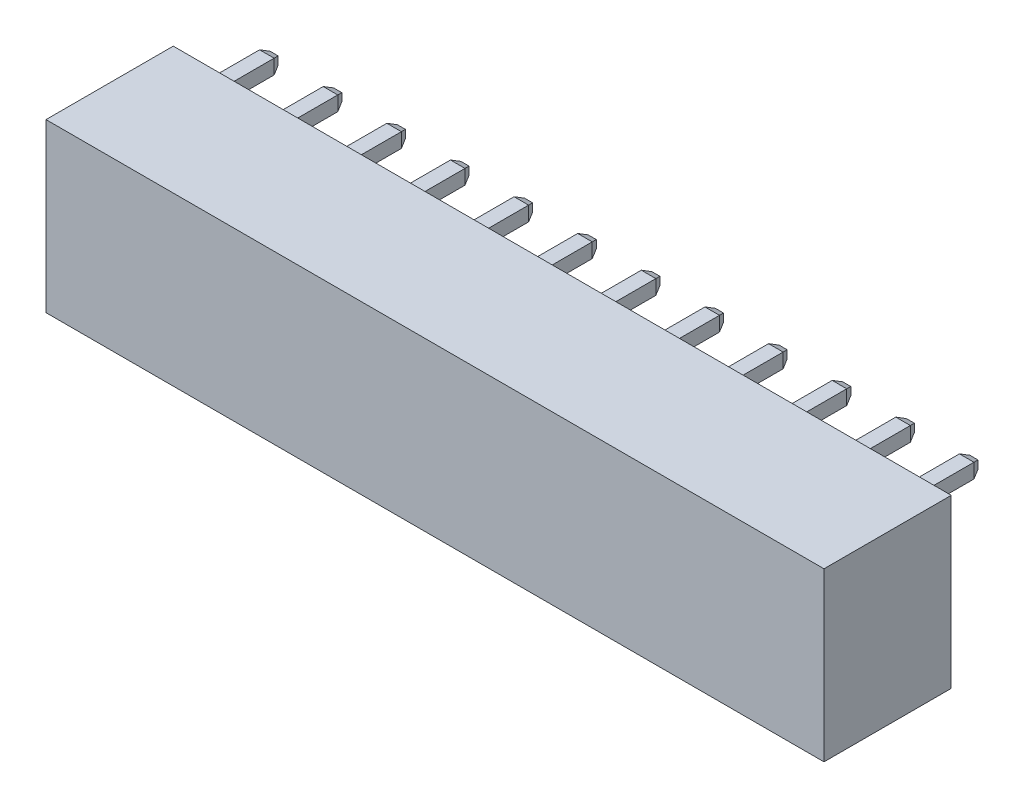
from build123d import *
from OCP.BRepFilletAPI import BRepFilletAPI_MakeChamfer

# Parameters (mm, degrees)
SKETCH_1_W                          = 42.8
SKETCH_1_H                          = 9.2
EXTRUDE_1_DEPTH                     = 7
SKETCH_2_W                          = 0.8
SKETCH_2_H                          = 0.8
EXTRUDE_2_DEPTH                     = 3.4
CHAMFER_1_SIZE                      = 0.4
CHAMFER_1_SIZE2                     = 0.178091474
CUT_EXTRUDE_1_DEPTH                 = 7
PATTERN_LINEAR_1_COUNT              = 12
PATTERN_LINEAR_1_PITCH              = 3.5
CHAMFER_1_OF_PATTERN_LINEAR_1_SIZE  = 0.4
CHAMFER_1_OF_PATTERN_LINEAR_1_SIZE2 = 0.178091474
PATTERN_LINEAR_2_COUNT              = 12
PATTERN_LINEAR_2_PITCH              = 3.5
SKETCH_4_W                          = 0.8
SKETCH_4_H                          = 0.8
EXTRUDE_3_DEPTH                     = 6
CHAMFER_2_SIZE                      = 0.4
CHAMFER_2_SIZE2                     = 0.178091474
PATTERN_LINEAR_3_COUNT              = 12
PATTERN_LINEAR_3_PITCH              = 3.5
CHAMFER_2_OF_PATTERN_LINEAR_3_SIZE  = 0.4
CHAMFER_2_OF_PATTERN_LINEAR_3_SIZE2 = 0.178091474


with BuildPart() as part:
    # Эскиз1 → Бобышка-Вытянуть1 (new body)
    with BuildSketch(Plane.XY):
        with Locations((0, 4.6)):
            Rectangle(SKETCH_1_W, SKETCH_1_H)
    extrude(amount=EXTRUDE_1_DEPTH)

    # Эскиз2 → Бобышка-Вытянуть2 (add)
    with BuildSketch(Plane(origin=(0, 0, 0), x_dir=(-1, 0, 0), z_dir=(0, 0, -1))):
        with Locations((-19.25, 8)):
            Rectangle(SKETCH_2_W, SKETCH_2_H)
    extrude_2 = extrude(amount=EXTRUDE_2_DEPTH)

    # Фаска1: one chamfer whose edges measure the first distance from different faces: ONE call of the kernel's chamfer builder (chamfer() names one face for all edges)
    chamfer_1_edges_1 = [part.edges().sort_by_distance(p)[0] for p in [
        (18.85, 8, -3.4),
    ]]
    chamfer_1_side_1 = [part.faces().sort_by_distance(p)[0] for p in [
        (18.85, 8, -1.7),
    ]]
    chamfer_1_edges_2 = [part.edges().sort_by_distance(p)[0] for p in [
        (19.25, 8.4, -3.4),
    ]]
    chamfer_1_side_2 = [part.faces().sort_by_distance(p)[0] for p in [
        (19.25, 8.4, -1.7),
    ]]
    chamfer_1_edges_3 = [part.edges().sort_by_distance(p)[0] for p in [
        (19.65, 8, -3.4),
    ]]
    chamfer_1_side_3 = [part.faces().sort_by_distance(p)[0] for p in [
        (19.65, 8, -1.7),
    ]]
    chamfer_1_edges_4 = [part.edges().sort_by_distance(p)[0] for p in [
        (19.25, 7.6, -3.4),
    ]]
    chamfer_1_side_4 = [part.faces().sort_by_distance(p)[0] for p in [
        (19.25, 7.6, -1.7),
    ]]
    chamfer_1 = BRepFilletAPI_MakeChamfer(part.part.solid().wrapped)
    for e in chamfer_1_edges_1:
        chamfer_1.Add(CHAMFER_1_SIZE, CHAMFER_1_SIZE2, e.wrapped, chamfer_1_side_1[0].wrapped)  # the first distance lies on this face
    for e in chamfer_1_edges_2:
        chamfer_1.Add(CHAMFER_1_SIZE, CHAMFER_1_SIZE2, e.wrapped, chamfer_1_side_2[0].wrapped)  # the first distance lies on this face
    for e in chamfer_1_edges_3:
        chamfer_1.Add(CHAMFER_1_SIZE, CHAMFER_1_SIZE2, e.wrapped, chamfer_1_side_3[0].wrapped)  # the first distance lies on this face
    for e in chamfer_1_edges_4:
        chamfer_1.Add(CHAMFER_1_SIZE, CHAMFER_1_SIZE2, e.wrapped, chamfer_1_side_4[0].wrapped)  # the first distance lies on this face
    add(Compound.cast(chamfer_1.Shape()), mode=Mode.REPLACE)

    # Эскиз3 → Вырез-Вытянуть1 (cut)
    with BuildSketch(Plane.XZ):
        Polygon((17.65, 0.8), (20.75, 0.8), (20.75, 5), (19.75, 5), (20.75, 6.5), (17.65, 6.5), (18.65, 5), (17.65, 5), align=None)
    cut_extrude_1 = extrude(amount=-CUT_EXTRUDE_1_DEPTH, mode=Mode.SUBTRACT)

    # Линейный массив1: Бобышка-Вытянуть2 ×12
    with Locations(*[(-i * PATTERN_LINEAR_1_PITCH, 0, 0) for i in range(1, PATTERN_LINEAR_1_COUNT)]):
        add(extrude_2)

    # Фаска1 of Линейный массив1: one chamfer whose edges measure the first distance from different faces: ONE call of the kernel's chamfer builder (chamfer() names one face for all edges)
    chamfer_1_of_pattern_linear_1_edges_1 = [part.edges().sort_by_distance(p)[0] for p in [
        (15.35, 8, -3.4),
    ]]
    chamfer_1_of_pattern_linear_1_side_1 = [part.faces().sort_by_distance(p)[0] for p in [
        (15.35, 8, -1.7),
    ]]
    chamfer_1_of_pattern_linear_1_edges_2 = [part.edges().sort_by_distance(p)[0] for p in [
        (15.75, 8.4, -3.4),
    ]]
    chamfer_1_of_pattern_linear_1_side_2 = [part.faces().sort_by_distance(p)[0] for p in [
        (15.75, 8.4, -1.7),
    ]]
    chamfer_1_of_pattern_linear_1_edges_3 = [part.edges().sort_by_distance(p)[0] for p in [
        (16.15, 8, -3.4),
    ]]
    chamfer_1_of_pattern_linear_1_side_3 = [part.faces().sort_by_distance(p)[0] for p in [
        (16.15, 8, -1.7),
    ]]
    chamfer_1_of_pattern_linear_1_edges_4 = [part.edges().sort_by_distance(p)[0] for p in [
        (15.75, 7.6, -3.4),
    ]]
    chamfer_1_of_pattern_linear_1_side_4 = [part.faces().sort_by_distance(p)[0] for p in [
        (15.75, 7.6, -1.7),
    ]]
    chamfer_1_of_pattern_linear_1_edges_5 = [part.edges().sort_by_distance(p)[0] for p in [
        (11.85, 8, -3.4),
    ]]
    chamfer_1_of_pattern_linear_1_side_5 = [part.faces().sort_by_distance(p)[0] for p in [
        (11.85, 8, -1.7),
    ]]
    chamfer_1_of_pattern_linear_1_edges_6 = [part.edges().sort_by_distance(p)[0] for p in [
        (12.25, 8.4, -3.4),
    ]]
    chamfer_1_of_pattern_linear_1_side_6 = [part.faces().sort_by_distance(p)[0] for p in [
        (12.25, 8.4, -1.7),
    ]]
    chamfer_1_of_pattern_linear_1_edges_7 = [part.edges().sort_by_distance(p)[0] for p in [
        (12.65, 8, -3.4),
    ]]
    chamfer_1_of_pattern_linear_1_side_7 = [part.faces().sort_by_distance(p)[0] for p in [
        (12.65, 8, -1.7),
    ]]
    chamfer_1_of_pattern_linear_1_edges_8 = [part.edges().sort_by_distance(p)[0] for p in [
        (12.25, 7.6, -3.4),
    ]]
    chamfer_1_of_pattern_linear_1_side_8 = [part.faces().sort_by_distance(p)[0] for p in [
        (12.25, 7.6, -1.7),
    ]]
    chamfer_1_of_pattern_linear_1_edges_9 = [part.edges().sort_by_distance(p)[0] for p in [
        (8.35, 8, -3.4),
    ]]
    chamfer_1_of_pattern_linear_1_side_9 = [part.faces().sort_by_distance(p)[0] for p in [
        (8.35, 8, -1.7),
    ]]
    chamfer_1_of_pattern_linear_1_edges_10 = [part.edges().sort_by_distance(p)[0] for p in [
        (8.75, 8.4, -3.4),
    ]]
    chamfer_1_of_pattern_linear_1_side_10 = [part.faces().sort_by_distance(p)[0] for p in [
        (8.75, 8.4, -1.7),
    ]]
    chamfer_1_of_pattern_linear_1_edges_11 = [part.edges().sort_by_distance(p)[0] for p in [
        (9.15, 8, -3.4),
    ]]
    chamfer_1_of_pattern_linear_1_side_11 = [part.faces().sort_by_distance(p)[0] for p in [
        (9.15, 8, -1.7),
    ]]
    chamfer_1_of_pattern_linear_1_edges_12 = [part.edges().sort_by_distance(p)[0] for p in [
        (8.75, 7.6, -3.4),
    ]]
    chamfer_1_of_pattern_linear_1_side_12 = [part.faces().sort_by_distance(p)[0] for p in [
        (8.75, 7.6, -1.7),
    ]]
    chamfer_1_of_pattern_linear_1_edges_13 = [part.edges().sort_by_distance(p)[0] for p in [
        (4.85, 8, -3.4),
    ]]
    chamfer_1_of_pattern_linear_1_side_13 = [part.faces().sort_by_distance(p)[0] for p in [
        (4.85, 8, -1.7),
    ]]
    chamfer_1_of_pattern_linear_1_edges_14 = [part.edges().sort_by_distance(p)[0] for p in [
        (5.25, 8.4, -3.4),
    ]]
    chamfer_1_of_pattern_linear_1_side_14 = [part.faces().sort_by_distance(p)[0] for p in [
        (5.25, 8.4, -1.7),
    ]]
    chamfer_1_of_pattern_linear_1_edges_15 = [part.edges().sort_by_distance(p)[0] for p in [
        (5.65, 8, -3.4),
    ]]
    chamfer_1_of_pattern_linear_1_side_15 = [part.faces().sort_by_distance(p)[0] for p in [
        (5.65, 8, -1.7),
    ]]
    chamfer_1_of_pattern_linear_1_edges_16 = [part.edges().sort_by_distance(p)[0] for p in [
        (5.25, 7.6, -3.4),
    ]]
    chamfer_1_of_pattern_linear_1_side_16 = [part.faces().sort_by_distance(p)[0] for p in [
        (5.25, 7.6, -1.7),
    ]]
    chamfer_1_of_pattern_linear_1_edges_17 = [part.edges().sort_by_distance(p)[0] for p in [
        (1.35, 8, -3.4),
    ]]
    chamfer_1_of_pattern_linear_1_side_17 = [part.faces().sort_by_distance(p)[0] for p in [
        (1.35, 8, -1.7),
    ]]
    chamfer_1_of_pattern_linear_1_edges_18 = [part.edges().sort_by_distance(p)[0] for p in [
        (1.75, 8.4, -3.4),
    ]]
    chamfer_1_of_pattern_linear_1_side_18 = [part.faces().sort_by_distance(p)[0] for p in [
        (1.75, 8.4, -1.7),
    ]]
    chamfer_1_of_pattern_linear_1_edges_19 = [part.edges().sort_by_distance(p)[0] for p in [
        (2.15, 8, -3.4),
    ]]
    chamfer_1_of_pattern_linear_1_side_19 = [part.faces().sort_by_distance(p)[0] for p in [
        (2.15, 8, -1.7),
    ]]
    chamfer_1_of_pattern_linear_1_edges_20 = [part.edges().sort_by_distance(p)[0] for p in [
        (1.75, 7.6, -3.4),
    ]]
    chamfer_1_of_pattern_linear_1_side_20 = [part.faces().sort_by_distance(p)[0] for p in [
        (1.75, 7.6, -1.7),
    ]]
    chamfer_1_of_pattern_linear_1_edges_21 = [part.edges().sort_by_distance(p)[0] for p in [
        (-2.15, 8, -3.4),
    ]]
    chamfer_1_of_pattern_linear_1_side_21 = [part.faces().sort_by_distance(p)[0] for p in [
        (-2.15, 8, -1.7),
    ]]
    chamfer_1_of_pattern_linear_1_edges_22 = [part.edges().sort_by_distance(p)[0] for p in [
        (-1.75, 8.4, -3.4),
    ]]
    chamfer_1_of_pattern_linear_1_side_22 = [part.faces().sort_by_distance(p)[0] for p in [
        (-1.75, 8.4, -1.7),
    ]]
    chamfer_1_of_pattern_linear_1_edges_23 = [part.edges().sort_by_distance(p)[0] for p in [
        (-1.35, 8, -3.4),
    ]]
    chamfer_1_of_pattern_linear_1_side_23 = [part.faces().sort_by_distance(p)[0] for p in [
        (-1.35, 8, -1.7),
    ]]
    chamfer_1_of_pattern_linear_1_edges_24 = [part.edges().sort_by_distance(p)[0] for p in [
        (-1.75, 7.6, -3.4),
    ]]
    chamfer_1_of_pattern_linear_1_side_24 = [part.faces().sort_by_distance(p)[0] for p in [
        (-1.75, 7.6, -1.7),
    ]]
    chamfer_1_of_pattern_linear_1_edges_25 = [part.edges().sort_by_distance(p)[0] for p in [
        (-5.65, 8, -3.4),
    ]]
    chamfer_1_of_pattern_linear_1_side_25 = [part.faces().sort_by_distance(p)[0] for p in [
        (-5.65, 8, -1.7),
    ]]
    chamfer_1_of_pattern_linear_1_edges_26 = [part.edges().sort_by_distance(p)[0] for p in [
        (-5.25, 8.4, -3.4),
    ]]
    chamfer_1_of_pattern_linear_1_side_26 = [part.faces().sort_by_distance(p)[0] for p in [
        (-5.25, 8.4, -1.7),
    ]]
    chamfer_1_of_pattern_linear_1_edges_27 = [part.edges().sort_by_distance(p)[0] for p in [
        (-4.85, 8, -3.4),
    ]]
    chamfer_1_of_pattern_linear_1_side_27 = [part.faces().sort_by_distance(p)[0] for p in [
        (-4.85, 8, -1.7),
    ]]
    chamfer_1_of_pattern_linear_1_edges_28 = [part.edges().sort_by_distance(p)[0] for p in [
        (-5.25, 7.6, -3.4),
    ]]
    chamfer_1_of_pattern_linear_1_side_28 = [part.faces().sort_by_distance(p)[0] for p in [
        (-5.25, 7.6, -1.7),
    ]]
    chamfer_1_of_pattern_linear_1_edges_29 = [part.edges().sort_by_distance(p)[0] for p in [
        (-9.15, 8, -3.4),
    ]]
    chamfer_1_of_pattern_linear_1_side_29 = [part.faces().sort_by_distance(p)[0] for p in [
        (-9.15, 8, -1.7),
    ]]
    chamfer_1_of_pattern_linear_1_edges_30 = [part.edges().sort_by_distance(p)[0] for p in [
        (-8.75, 8.4, -3.4),
    ]]
    chamfer_1_of_pattern_linear_1_side_30 = [part.faces().sort_by_distance(p)[0] for p in [
        (-8.75, 8.4, -1.7),
    ]]
    chamfer_1_of_pattern_linear_1_edges_31 = [part.edges().sort_by_distance(p)[0] for p in [
        (-8.35, 8, -3.4),
    ]]
    chamfer_1_of_pattern_linear_1_side_31 = [part.faces().sort_by_distance(p)[0] for p in [
        (-8.35, 8, -1.7),
    ]]
    chamfer_1_of_pattern_linear_1_edges_32 = [part.edges().sort_by_distance(p)[0] for p in [
        (-8.75, 7.6, -3.4),
    ]]
    chamfer_1_of_pattern_linear_1_side_32 = [part.faces().sort_by_distance(p)[0] for p in [
        (-8.75, 7.6, -1.7),
    ]]
    chamfer_1_of_pattern_linear_1_edges_33 = [part.edges().sort_by_distance(p)[0] for p in [
        (-12.65, 8, -3.4),
    ]]
    chamfer_1_of_pattern_linear_1_side_33 = [part.faces().sort_by_distance(p)[0] for p in [
        (-12.65, 8, -1.7),
    ]]
    chamfer_1_of_pattern_linear_1_edges_34 = [part.edges().sort_by_distance(p)[0] for p in [
        (-12.25, 8.4, -3.4),
    ]]
    chamfer_1_of_pattern_linear_1_side_34 = [part.faces().sort_by_distance(p)[0] for p in [
        (-12.25, 8.4, -1.7),
    ]]
    chamfer_1_of_pattern_linear_1_edges_35 = [part.edges().sort_by_distance(p)[0] for p in [
        (-11.85, 8, -3.4),
    ]]
    chamfer_1_of_pattern_linear_1_side_35 = [part.faces().sort_by_distance(p)[0] for p in [
        (-11.85, 8, -1.7),
    ]]
    chamfer_1_of_pattern_linear_1_edges_36 = [part.edges().sort_by_distance(p)[0] for p in [
        (-12.25, 7.6, -3.4),
    ]]
    chamfer_1_of_pattern_linear_1_side_36 = [part.faces().sort_by_distance(p)[0] for p in [
        (-12.25, 7.6, -1.7),
    ]]
    chamfer_1_of_pattern_linear_1_edges_37 = [part.edges().sort_by_distance(p)[0] for p in [
        (-16.15, 8, -3.4),
    ]]
    chamfer_1_of_pattern_linear_1_side_37 = [part.faces().sort_by_distance(p)[0] for p in [
        (-16.15, 8, -1.7),
    ]]
    chamfer_1_of_pattern_linear_1_edges_38 = [part.edges().sort_by_distance(p)[0] for p in [
        (-15.75, 8.4, -3.4),
    ]]
    chamfer_1_of_pattern_linear_1_side_38 = [part.faces().sort_by_distance(p)[0] for p in [
        (-15.75, 8.4, -1.7),
    ]]
    chamfer_1_of_pattern_linear_1_edges_39 = [part.edges().sort_by_distance(p)[0] for p in [
        (-15.35, 8, -3.4),
    ]]
    chamfer_1_of_pattern_linear_1_side_39 = [part.faces().sort_by_distance(p)[0] for p in [
        (-15.35, 8, -1.7),
    ]]
    chamfer_1_of_pattern_linear_1_edges_40 = [part.edges().sort_by_distance(p)[0] for p in [
        (-15.75, 7.6, -3.4),
    ]]
    chamfer_1_of_pattern_linear_1_side_40 = [part.faces().sort_by_distance(p)[0] for p in [
        (-15.75, 7.6, -1.7),
    ]]
    chamfer_1_of_pattern_linear_1_edges_41 = [part.edges().sort_by_distance(p)[0] for p in [
        (-19.65, 8, -3.4),
    ]]
    chamfer_1_of_pattern_linear_1_side_41 = [part.faces().sort_by_distance(p)[0] for p in [
        (-19.65, 8, -1.7),
    ]]
    chamfer_1_of_pattern_linear_1_edges_42 = [part.edges().sort_by_distance(p)[0] for p in [
        (-19.25, 8.4, -3.4),
    ]]
    chamfer_1_of_pattern_linear_1_side_42 = [part.faces().sort_by_distance(p)[0] for p in [
        (-19.25, 8.4, -1.7),
    ]]
    chamfer_1_of_pattern_linear_1_edges_43 = [part.edges().sort_by_distance(p)[0] for p in [
        (-18.85, 8, -3.4),
    ]]
    chamfer_1_of_pattern_linear_1_side_43 = [part.faces().sort_by_distance(p)[0] for p in [
        (-18.85, 8, -1.7),
    ]]
    chamfer_1_of_pattern_linear_1_edges_44 = [part.edges().sort_by_distance(p)[0] for p in [
        (-19.25, 7.6, -3.4),
    ]]
    chamfer_1_of_pattern_linear_1_side_44 = [part.faces().sort_by_distance(p)[0] for p in [
        (-19.25, 7.6, -1.7),
    ]]
    chamfer_1_of_pattern_linear_1 = BRepFilletAPI_MakeChamfer(part.part.solid().wrapped)
    for e in chamfer_1_of_pattern_linear_1_edges_1:
        chamfer_1_of_pattern_linear_1.Add(CHAMFER_1_OF_PATTERN_LINEAR_1_SIZE, CHAMFER_1_OF_PATTERN_LINEAR_1_SIZE2, e.wrapped, chamfer_1_of_pattern_linear_1_side_1[0].wrapped)  # the first distance lies on this face
    for e in chamfer_1_of_pattern_linear_1_edges_2:
        chamfer_1_of_pattern_linear_1.Add(CHAMFER_1_OF_PATTERN_LINEAR_1_SIZE, CHAMFER_1_OF_PATTERN_LINEAR_1_SIZE2, e.wrapped, chamfer_1_of_pattern_linear_1_side_2[0].wrapped)  # the first distance lies on this face
    for e in chamfer_1_of_pattern_linear_1_edges_3:
        chamfer_1_of_pattern_linear_1.Add(CHAMFER_1_OF_PATTERN_LINEAR_1_SIZE, CHAMFER_1_OF_PATTERN_LINEAR_1_SIZE2, e.wrapped, chamfer_1_of_pattern_linear_1_side_3[0].wrapped)  # the first distance lies on this face
    for e in chamfer_1_of_pattern_linear_1_edges_4:
        chamfer_1_of_pattern_linear_1.Add(CHAMFER_1_OF_PATTERN_LINEAR_1_SIZE, CHAMFER_1_OF_PATTERN_LINEAR_1_SIZE2, e.wrapped, chamfer_1_of_pattern_linear_1_side_4[0].wrapped)  # the first distance lies on this face
    for e in chamfer_1_of_pattern_linear_1_edges_5:
        chamfer_1_of_pattern_linear_1.Add(CHAMFER_1_OF_PATTERN_LINEAR_1_SIZE, CHAMFER_1_OF_PATTERN_LINEAR_1_SIZE2, e.wrapped, chamfer_1_of_pattern_linear_1_side_5[0].wrapped)  # the first distance lies on this face
    for e in chamfer_1_of_pattern_linear_1_edges_6:
        chamfer_1_of_pattern_linear_1.Add(CHAMFER_1_OF_PATTERN_LINEAR_1_SIZE, CHAMFER_1_OF_PATTERN_LINEAR_1_SIZE2, e.wrapped, chamfer_1_of_pattern_linear_1_side_6[0].wrapped)  # the first distance lies on this face
    for e in chamfer_1_of_pattern_linear_1_edges_7:
        chamfer_1_of_pattern_linear_1.Add(CHAMFER_1_OF_PATTERN_LINEAR_1_SIZE, CHAMFER_1_OF_PATTERN_LINEAR_1_SIZE2, e.wrapped, chamfer_1_of_pattern_linear_1_side_7[0].wrapped)  # the first distance lies on this face
    for e in chamfer_1_of_pattern_linear_1_edges_8:
        chamfer_1_of_pattern_linear_1.Add(CHAMFER_1_OF_PATTERN_LINEAR_1_SIZE, CHAMFER_1_OF_PATTERN_LINEAR_1_SIZE2, e.wrapped, chamfer_1_of_pattern_linear_1_side_8[0].wrapped)  # the first distance lies on this face
    for e in chamfer_1_of_pattern_linear_1_edges_9:
        chamfer_1_of_pattern_linear_1.Add(CHAMFER_1_OF_PATTERN_LINEAR_1_SIZE, CHAMFER_1_OF_PATTERN_LINEAR_1_SIZE2, e.wrapped, chamfer_1_of_pattern_linear_1_side_9[0].wrapped)  # the first distance lies on this face
    for e in chamfer_1_of_pattern_linear_1_edges_10:
        chamfer_1_of_pattern_linear_1.Add(CHAMFER_1_OF_PATTERN_LINEAR_1_SIZE, CHAMFER_1_OF_PATTERN_LINEAR_1_SIZE2, e.wrapped, chamfer_1_of_pattern_linear_1_side_10[0].wrapped)  # the first distance lies on this face
    for e in chamfer_1_of_pattern_linear_1_edges_11:
        chamfer_1_of_pattern_linear_1.Add(CHAMFER_1_OF_PATTERN_LINEAR_1_SIZE, CHAMFER_1_OF_PATTERN_LINEAR_1_SIZE2, e.wrapped, chamfer_1_of_pattern_linear_1_side_11[0].wrapped)  # the first distance lies on this face
    for e in chamfer_1_of_pattern_linear_1_edges_12:
        chamfer_1_of_pattern_linear_1.Add(CHAMFER_1_OF_PATTERN_LINEAR_1_SIZE, CHAMFER_1_OF_PATTERN_LINEAR_1_SIZE2, e.wrapped, chamfer_1_of_pattern_linear_1_side_12[0].wrapped)  # the first distance lies on this face
    for e in chamfer_1_of_pattern_linear_1_edges_13:
        chamfer_1_of_pattern_linear_1.Add(CHAMFER_1_OF_PATTERN_LINEAR_1_SIZE, CHAMFER_1_OF_PATTERN_LINEAR_1_SIZE2, e.wrapped, chamfer_1_of_pattern_linear_1_side_13[0].wrapped)  # the first distance lies on this face
    for e in chamfer_1_of_pattern_linear_1_edges_14:
        chamfer_1_of_pattern_linear_1.Add(CHAMFER_1_OF_PATTERN_LINEAR_1_SIZE, CHAMFER_1_OF_PATTERN_LINEAR_1_SIZE2, e.wrapped, chamfer_1_of_pattern_linear_1_side_14[0].wrapped)  # the first distance lies on this face
    for e in chamfer_1_of_pattern_linear_1_edges_15:
        chamfer_1_of_pattern_linear_1.Add(CHAMFER_1_OF_PATTERN_LINEAR_1_SIZE, CHAMFER_1_OF_PATTERN_LINEAR_1_SIZE2, e.wrapped, chamfer_1_of_pattern_linear_1_side_15[0].wrapped)  # the first distance lies on this face
    for e in chamfer_1_of_pattern_linear_1_edges_16:
        chamfer_1_of_pattern_linear_1.Add(CHAMFER_1_OF_PATTERN_LINEAR_1_SIZE, CHAMFER_1_OF_PATTERN_LINEAR_1_SIZE2, e.wrapped, chamfer_1_of_pattern_linear_1_side_16[0].wrapped)  # the first distance lies on this face
    for e in chamfer_1_of_pattern_linear_1_edges_17:
        chamfer_1_of_pattern_linear_1.Add(CHAMFER_1_OF_PATTERN_LINEAR_1_SIZE, CHAMFER_1_OF_PATTERN_LINEAR_1_SIZE2, e.wrapped, chamfer_1_of_pattern_linear_1_side_17[0].wrapped)  # the first distance lies on this face
    for e in chamfer_1_of_pattern_linear_1_edges_18:
        chamfer_1_of_pattern_linear_1.Add(CHAMFER_1_OF_PATTERN_LINEAR_1_SIZE, CHAMFER_1_OF_PATTERN_LINEAR_1_SIZE2, e.wrapped, chamfer_1_of_pattern_linear_1_side_18[0].wrapped)  # the first distance lies on this face
    for e in chamfer_1_of_pattern_linear_1_edges_19:
        chamfer_1_of_pattern_linear_1.Add(CHAMFER_1_OF_PATTERN_LINEAR_1_SIZE, CHAMFER_1_OF_PATTERN_LINEAR_1_SIZE2, e.wrapped, chamfer_1_of_pattern_linear_1_side_19[0].wrapped)  # the first distance lies on this face
    for e in chamfer_1_of_pattern_linear_1_edges_20:
        chamfer_1_of_pattern_linear_1.Add(CHAMFER_1_OF_PATTERN_LINEAR_1_SIZE, CHAMFER_1_OF_PATTERN_LINEAR_1_SIZE2, e.wrapped, chamfer_1_of_pattern_linear_1_side_20[0].wrapped)  # the first distance lies on this face
    for e in chamfer_1_of_pattern_linear_1_edges_21:
        chamfer_1_of_pattern_linear_1.Add(CHAMFER_1_OF_PATTERN_LINEAR_1_SIZE, CHAMFER_1_OF_PATTERN_LINEAR_1_SIZE2, e.wrapped, chamfer_1_of_pattern_linear_1_side_21[0].wrapped)  # the first distance lies on this face
    for e in chamfer_1_of_pattern_linear_1_edges_22:
        chamfer_1_of_pattern_linear_1.Add(CHAMFER_1_OF_PATTERN_LINEAR_1_SIZE, CHAMFER_1_OF_PATTERN_LINEAR_1_SIZE2, e.wrapped, chamfer_1_of_pattern_linear_1_side_22[0].wrapped)  # the first distance lies on this face
    for e in chamfer_1_of_pattern_linear_1_edges_23:
        chamfer_1_of_pattern_linear_1.Add(CHAMFER_1_OF_PATTERN_LINEAR_1_SIZE, CHAMFER_1_OF_PATTERN_LINEAR_1_SIZE2, e.wrapped, chamfer_1_of_pattern_linear_1_side_23[0].wrapped)  # the first distance lies on this face
    for e in chamfer_1_of_pattern_linear_1_edges_24:
        chamfer_1_of_pattern_linear_1.Add(CHAMFER_1_OF_PATTERN_LINEAR_1_SIZE, CHAMFER_1_OF_PATTERN_LINEAR_1_SIZE2, e.wrapped, chamfer_1_of_pattern_linear_1_side_24[0].wrapped)  # the first distance lies on this face
    for e in chamfer_1_of_pattern_linear_1_edges_25:
        chamfer_1_of_pattern_linear_1.Add(CHAMFER_1_OF_PATTERN_LINEAR_1_SIZE, CHAMFER_1_OF_PATTERN_LINEAR_1_SIZE2, e.wrapped, chamfer_1_of_pattern_linear_1_side_25[0].wrapped)  # the first distance lies on this face
    for e in chamfer_1_of_pattern_linear_1_edges_26:
        chamfer_1_of_pattern_linear_1.Add(CHAMFER_1_OF_PATTERN_LINEAR_1_SIZE, CHAMFER_1_OF_PATTERN_LINEAR_1_SIZE2, e.wrapped, chamfer_1_of_pattern_linear_1_side_26[0].wrapped)  # the first distance lies on this face
    for e in chamfer_1_of_pattern_linear_1_edges_27:
        chamfer_1_of_pattern_linear_1.Add(CHAMFER_1_OF_PATTERN_LINEAR_1_SIZE, CHAMFER_1_OF_PATTERN_LINEAR_1_SIZE2, e.wrapped, chamfer_1_of_pattern_linear_1_side_27[0].wrapped)  # the first distance lies on this face
    for e in chamfer_1_of_pattern_linear_1_edges_28:
        chamfer_1_of_pattern_linear_1.Add(CHAMFER_1_OF_PATTERN_LINEAR_1_SIZE, CHAMFER_1_OF_PATTERN_LINEAR_1_SIZE2, e.wrapped, chamfer_1_of_pattern_linear_1_side_28[0].wrapped)  # the first distance lies on this face
    for e in chamfer_1_of_pattern_linear_1_edges_29:
        chamfer_1_of_pattern_linear_1.Add(CHAMFER_1_OF_PATTERN_LINEAR_1_SIZE, CHAMFER_1_OF_PATTERN_LINEAR_1_SIZE2, e.wrapped, chamfer_1_of_pattern_linear_1_side_29[0].wrapped)  # the first distance lies on this face
    for e in chamfer_1_of_pattern_linear_1_edges_30:
        chamfer_1_of_pattern_linear_1.Add(CHAMFER_1_OF_PATTERN_LINEAR_1_SIZE, CHAMFER_1_OF_PATTERN_LINEAR_1_SIZE2, e.wrapped, chamfer_1_of_pattern_linear_1_side_30[0].wrapped)  # the first distance lies on this face
    for e in chamfer_1_of_pattern_linear_1_edges_31:
        chamfer_1_of_pattern_linear_1.Add(CHAMFER_1_OF_PATTERN_LINEAR_1_SIZE, CHAMFER_1_OF_PATTERN_LINEAR_1_SIZE2, e.wrapped, chamfer_1_of_pattern_linear_1_side_31[0].wrapped)  # the first distance lies on this face
    for e in chamfer_1_of_pattern_linear_1_edges_32:
        chamfer_1_of_pattern_linear_1.Add(CHAMFER_1_OF_PATTERN_LINEAR_1_SIZE, CHAMFER_1_OF_PATTERN_LINEAR_1_SIZE2, e.wrapped, chamfer_1_of_pattern_linear_1_side_32[0].wrapped)  # the first distance lies on this face
    for e in chamfer_1_of_pattern_linear_1_edges_33:
        chamfer_1_of_pattern_linear_1.Add(CHAMFER_1_OF_PATTERN_LINEAR_1_SIZE, CHAMFER_1_OF_PATTERN_LINEAR_1_SIZE2, e.wrapped, chamfer_1_of_pattern_linear_1_side_33[0].wrapped)  # the first distance lies on this face
    for e in chamfer_1_of_pattern_linear_1_edges_34:
        chamfer_1_of_pattern_linear_1.Add(CHAMFER_1_OF_PATTERN_LINEAR_1_SIZE, CHAMFER_1_OF_PATTERN_LINEAR_1_SIZE2, e.wrapped, chamfer_1_of_pattern_linear_1_side_34[0].wrapped)  # the first distance lies on this face
    for e in chamfer_1_of_pattern_linear_1_edges_35:
        chamfer_1_of_pattern_linear_1.Add(CHAMFER_1_OF_PATTERN_LINEAR_1_SIZE, CHAMFER_1_OF_PATTERN_LINEAR_1_SIZE2, e.wrapped, chamfer_1_of_pattern_linear_1_side_35[0].wrapped)  # the first distance lies on this face
    for e in chamfer_1_of_pattern_linear_1_edges_36:
        chamfer_1_of_pattern_linear_1.Add(CHAMFER_1_OF_PATTERN_LINEAR_1_SIZE, CHAMFER_1_OF_PATTERN_LINEAR_1_SIZE2, e.wrapped, chamfer_1_of_pattern_linear_1_side_36[0].wrapped)  # the first distance lies on this face
    for e in chamfer_1_of_pattern_linear_1_edges_37:
        chamfer_1_of_pattern_linear_1.Add(CHAMFER_1_OF_PATTERN_LINEAR_1_SIZE, CHAMFER_1_OF_PATTERN_LINEAR_1_SIZE2, e.wrapped, chamfer_1_of_pattern_linear_1_side_37[0].wrapped)  # the first distance lies on this face
    for e in chamfer_1_of_pattern_linear_1_edges_38:
        chamfer_1_of_pattern_linear_1.Add(CHAMFER_1_OF_PATTERN_LINEAR_1_SIZE, CHAMFER_1_OF_PATTERN_LINEAR_1_SIZE2, e.wrapped, chamfer_1_of_pattern_linear_1_side_38[0].wrapped)  # the first distance lies on this face
    for e in chamfer_1_of_pattern_linear_1_edges_39:
        chamfer_1_of_pattern_linear_1.Add(CHAMFER_1_OF_PATTERN_LINEAR_1_SIZE, CHAMFER_1_OF_PATTERN_LINEAR_1_SIZE2, e.wrapped, chamfer_1_of_pattern_linear_1_side_39[0].wrapped)  # the first distance lies on this face
    for e in chamfer_1_of_pattern_linear_1_edges_40:
        chamfer_1_of_pattern_linear_1.Add(CHAMFER_1_OF_PATTERN_LINEAR_1_SIZE, CHAMFER_1_OF_PATTERN_LINEAR_1_SIZE2, e.wrapped, chamfer_1_of_pattern_linear_1_side_40[0].wrapped)  # the first distance lies on this face
    for e in chamfer_1_of_pattern_linear_1_edges_41:
        chamfer_1_of_pattern_linear_1.Add(CHAMFER_1_OF_PATTERN_LINEAR_1_SIZE, CHAMFER_1_OF_PATTERN_LINEAR_1_SIZE2, e.wrapped, chamfer_1_of_pattern_linear_1_side_41[0].wrapped)  # the first distance lies on this face
    for e in chamfer_1_of_pattern_linear_1_edges_42:
        chamfer_1_of_pattern_linear_1.Add(CHAMFER_1_OF_PATTERN_LINEAR_1_SIZE, CHAMFER_1_OF_PATTERN_LINEAR_1_SIZE2, e.wrapped, chamfer_1_of_pattern_linear_1_side_42[0].wrapped)  # the first distance lies on this face
    for e in chamfer_1_of_pattern_linear_1_edges_43:
        chamfer_1_of_pattern_linear_1.Add(CHAMFER_1_OF_PATTERN_LINEAR_1_SIZE, CHAMFER_1_OF_PATTERN_LINEAR_1_SIZE2, e.wrapped, chamfer_1_of_pattern_linear_1_side_43[0].wrapped)  # the first distance lies on this face
    for e in chamfer_1_of_pattern_linear_1_edges_44:
        chamfer_1_of_pattern_linear_1.Add(CHAMFER_1_OF_PATTERN_LINEAR_1_SIZE, CHAMFER_1_OF_PATTERN_LINEAR_1_SIZE2, e.wrapped, chamfer_1_of_pattern_linear_1_side_44[0].wrapped)  # the first distance lies on this face
    add(Compound.cast(chamfer_1_of_pattern_linear_1.Shape()), mode=Mode.REPLACE)

    # Линейный массив2: Вырез-Вытянуть1 ×12
    with Locations(*[(-i * PATTERN_LINEAR_2_PITCH, 0, 0) for i in range(1, PATTERN_LINEAR_2_COUNT)]):
        add(cut_extrude_1, mode=Mode.SUBTRACT)

    # Эскиз4 → Бобышка-Вытянуть3 (add)
    with BuildSketch(Plane.XZ.offset(-7)):
        with Locations((19.25, 3)):
            Rectangle(SKETCH_4_W, SKETCH_4_H)
    extrude_3 = extrude(amount=EXTRUDE_3_DEPTH)

    # Фаска2: one chamfer whose edges measure the first distance from different faces: ONE call of the kernel's chamfer builder (chamfer() names one face for all edges)
    chamfer_2_edges_1 = [part.edges().sort_by_distance(p)[0] for p in [
        (19.65, 1, 3),
    ]]
    chamfer_2_side_1 = [part.faces().sort_by_distance(p)[0] for p in [
        (19.65, 4, 3),
    ]]
    chamfer_2_edges_2 = [part.edges().sort_by_distance(p)[0] for p in [
        (19.25, 1, 3.4),
    ]]
    chamfer_2_side_2 = [part.faces().sort_by_distance(p)[0] for p in [
        (19.25, 4, 3.4),
    ]]
    chamfer_2_edges_3 = [part.edges().sort_by_distance(p)[0] for p in [
        (18.85, 1, 3),
    ]]
    chamfer_2_side_3 = [part.faces().sort_by_distance(p)[0] for p in [
        (18.85, 4, 3),
    ]]
    chamfer_2_edges_4 = [part.edges().sort_by_distance(p)[0] for p in [
        (19.25, 1, 2.6),
    ]]
    chamfer_2_side_4 = [part.faces().sort_by_distance(p)[0] for p in [
        (19.25, 4, 2.6),
    ]]
    chamfer_2 = BRepFilletAPI_MakeChamfer(part.part.solid().wrapped)
    for e in chamfer_2_edges_1:
        chamfer_2.Add(CHAMFER_2_SIZE, CHAMFER_2_SIZE2, e.wrapped, chamfer_2_side_1[0].wrapped)  # the first distance lies on this face
    for e in chamfer_2_edges_2:
        chamfer_2.Add(CHAMFER_2_SIZE, CHAMFER_2_SIZE2, e.wrapped, chamfer_2_side_2[0].wrapped)  # the first distance lies on this face
    for e in chamfer_2_edges_3:
        chamfer_2.Add(CHAMFER_2_SIZE, CHAMFER_2_SIZE2, e.wrapped, chamfer_2_side_3[0].wrapped)  # the first distance lies on this face
    for e in chamfer_2_edges_4:
        chamfer_2.Add(CHAMFER_2_SIZE, CHAMFER_2_SIZE2, e.wrapped, chamfer_2_side_4[0].wrapped)  # the first distance lies on this face
    add(Compound.cast(chamfer_2.Shape()), mode=Mode.REPLACE)

    # Линейный массив3: Бобышка-Вытянуть3 ×12
    with Locations(*[(-i * PATTERN_LINEAR_3_PITCH, 0, 0) for i in range(1, PATTERN_LINEAR_3_COUNT)]):
        add(extrude_3)

    # Фаска2 of Линейный массив3: one chamfer whose edges measure the first distance from different faces: ONE call of the kernel's chamfer builder (chamfer() names one face for all edges)
    chamfer_2_of_pattern_linear_3_edges_1 = [part.edges().sort_by_distance(p)[0] for p in [
        (16.15, 1, 3),
    ]]
    chamfer_2_of_pattern_linear_3_side_1 = [part.faces().sort_by_distance(p)[0] for p in [
        (16.15, 4, 3),
    ]]
    chamfer_2_of_pattern_linear_3_edges_2 = [part.edges().sort_by_distance(p)[0] for p in [
        (15.75, 1, 3.4),
    ]]
    chamfer_2_of_pattern_linear_3_side_2 = [part.faces().sort_by_distance(p)[0] for p in [
        (15.75, 4, 3.4),
    ]]
    chamfer_2_of_pattern_linear_3_edges_3 = [part.edges().sort_by_distance(p)[0] for p in [
        (15.35, 1, 3),
    ]]
    chamfer_2_of_pattern_linear_3_side_3 = [part.faces().sort_by_distance(p)[0] for p in [
        (15.35, 4, 3),
    ]]
    chamfer_2_of_pattern_linear_3_edges_4 = [part.edges().sort_by_distance(p)[0] for p in [
        (15.75, 1, 2.6),
    ]]
    chamfer_2_of_pattern_linear_3_side_4 = [part.faces().sort_by_distance(p)[0] for p in [
        (15.75, 4, 2.6),
    ]]
    chamfer_2_of_pattern_linear_3_edges_5 = [part.edges().sort_by_distance(p)[0] for p in [
        (12.65, 1, 3),
    ]]
    chamfer_2_of_pattern_linear_3_side_5 = [part.faces().sort_by_distance(p)[0] for p in [
        (12.65, 4, 3),
    ]]
    chamfer_2_of_pattern_linear_3_edges_6 = [part.edges().sort_by_distance(p)[0] for p in [
        (12.25, 1, 3.4),
    ]]
    chamfer_2_of_pattern_linear_3_side_6 = [part.faces().sort_by_distance(p)[0] for p in [
        (12.25, 4, 3.4),
    ]]
    chamfer_2_of_pattern_linear_3_edges_7 = [part.edges().sort_by_distance(p)[0] for p in [
        (11.85, 1, 3),
    ]]
    chamfer_2_of_pattern_linear_3_side_7 = [part.faces().sort_by_distance(p)[0] for p in [
        (11.85, 4, 3),
    ]]
    chamfer_2_of_pattern_linear_3_edges_8 = [part.edges().sort_by_distance(p)[0] for p in [
        (12.25, 1, 2.6),
    ]]
    chamfer_2_of_pattern_linear_3_side_8 = [part.faces().sort_by_distance(p)[0] for p in [
        (12.25, 4, 2.6),
    ]]
    chamfer_2_of_pattern_linear_3_edges_9 = [part.edges().sort_by_distance(p)[0] for p in [
        (9.15, 1, 3),
    ]]
    chamfer_2_of_pattern_linear_3_side_9 = [part.faces().sort_by_distance(p)[0] for p in [
        (9.15, 4, 3),
    ]]
    chamfer_2_of_pattern_linear_3_edges_10 = [part.edges().sort_by_distance(p)[0] for p in [
        (8.75, 1, 3.4),
    ]]
    chamfer_2_of_pattern_linear_3_side_10 = [part.faces().sort_by_distance(p)[0] for p in [
        (8.75, 4, 3.4),
    ]]
    chamfer_2_of_pattern_linear_3_edges_11 = [part.edges().sort_by_distance(p)[0] for p in [
        (8.35, 1, 3),
    ]]
    chamfer_2_of_pattern_linear_3_side_11 = [part.faces().sort_by_distance(p)[0] for p in [
        (8.35, 4, 3),
    ]]
    chamfer_2_of_pattern_linear_3_edges_12 = [part.edges().sort_by_distance(p)[0] for p in [
        (8.75, 1, 2.6),
    ]]
    chamfer_2_of_pattern_linear_3_side_12 = [part.faces().sort_by_distance(p)[0] for p in [
        (8.75, 4, 2.6),
    ]]
    chamfer_2_of_pattern_linear_3_edges_13 = [part.edges().sort_by_distance(p)[0] for p in [
        (5.65, 1, 3),
    ]]
    chamfer_2_of_pattern_linear_3_side_13 = [part.faces().sort_by_distance(p)[0] for p in [
        (5.65, 4, 3),
    ]]
    chamfer_2_of_pattern_linear_3_edges_14 = [part.edges().sort_by_distance(p)[0] for p in [
        (5.25, 1, 3.4),
    ]]
    chamfer_2_of_pattern_linear_3_side_14 = [part.faces().sort_by_distance(p)[0] for p in [
        (5.25, 4, 3.4),
    ]]
    chamfer_2_of_pattern_linear_3_edges_15 = [part.edges().sort_by_distance(p)[0] for p in [
        (4.85, 1, 3),
    ]]
    chamfer_2_of_pattern_linear_3_side_15 = [part.faces().sort_by_distance(p)[0] for p in [
        (4.85, 4, 3),
    ]]
    chamfer_2_of_pattern_linear_3_edges_16 = [part.edges().sort_by_distance(p)[0] for p in [
        (5.25, 1, 2.6),
    ]]
    chamfer_2_of_pattern_linear_3_side_16 = [part.faces().sort_by_distance(p)[0] for p in [
        (5.25, 4, 2.6),
    ]]
    chamfer_2_of_pattern_linear_3_edges_17 = [part.edges().sort_by_distance(p)[0] for p in [
        (2.15, 1, 3),
    ]]
    chamfer_2_of_pattern_linear_3_side_17 = [part.faces().sort_by_distance(p)[0] for p in [
        (2.15, 4, 3),
    ]]
    chamfer_2_of_pattern_linear_3_edges_18 = [part.edges().sort_by_distance(p)[0] for p in [
        (1.75, 1, 3.4),
    ]]
    chamfer_2_of_pattern_linear_3_side_18 = [part.faces().sort_by_distance(p)[0] for p in [
        (1.75, 4, 3.4),
    ]]
    chamfer_2_of_pattern_linear_3_edges_19 = [part.edges().sort_by_distance(p)[0] for p in [
        (1.35, 1, 3),
    ]]
    chamfer_2_of_pattern_linear_3_side_19 = [part.faces().sort_by_distance(p)[0] for p in [
        (1.35, 4, 3),
    ]]
    chamfer_2_of_pattern_linear_3_edges_20 = [part.edges().sort_by_distance(p)[0] for p in [
        (1.75, 1, 2.6),
    ]]
    chamfer_2_of_pattern_linear_3_side_20 = [part.faces().sort_by_distance(p)[0] for p in [
        (1.75, 4, 2.6),
    ]]
    chamfer_2_of_pattern_linear_3_edges_21 = [part.edges().sort_by_distance(p)[0] for p in [
        (-1.35, 1, 3),
    ]]
    chamfer_2_of_pattern_linear_3_side_21 = [part.faces().sort_by_distance(p)[0] for p in [
        (-1.35, 4, 3),
    ]]
    chamfer_2_of_pattern_linear_3_edges_22 = [part.edges().sort_by_distance(p)[0] for p in [
        (-1.75, 1, 3.4),
    ]]
    chamfer_2_of_pattern_linear_3_side_22 = [part.faces().sort_by_distance(p)[0] for p in [
        (-1.75, 4, 3.4),
    ]]
    chamfer_2_of_pattern_linear_3_edges_23 = [part.edges().sort_by_distance(p)[0] for p in [
        (-2.15, 1, 3),
    ]]
    chamfer_2_of_pattern_linear_3_side_23 = [part.faces().sort_by_distance(p)[0] for p in [
        (-2.15, 4, 3),
    ]]
    chamfer_2_of_pattern_linear_3_edges_24 = [part.edges().sort_by_distance(p)[0] for p in [
        (-1.75, 1, 2.6),
    ]]
    chamfer_2_of_pattern_linear_3_side_24 = [part.faces().sort_by_distance(p)[0] for p in [
        (-1.75, 4, 2.6),
    ]]
    chamfer_2_of_pattern_linear_3_edges_25 = [part.edges().sort_by_distance(p)[0] for p in [
        (-4.85, 1, 3),
    ]]
    chamfer_2_of_pattern_linear_3_side_25 = [part.faces().sort_by_distance(p)[0] for p in [
        (-4.85, 4, 3),
    ]]
    chamfer_2_of_pattern_linear_3_edges_26 = [part.edges().sort_by_distance(p)[0] for p in [
        (-5.25, 1, 3.4),
    ]]
    chamfer_2_of_pattern_linear_3_side_26 = [part.faces().sort_by_distance(p)[0] for p in [
        (-5.25, 4, 3.4),
    ]]
    chamfer_2_of_pattern_linear_3_edges_27 = [part.edges().sort_by_distance(p)[0] for p in [
        (-5.65, 1, 3),
    ]]
    chamfer_2_of_pattern_linear_3_side_27 = [part.faces().sort_by_distance(p)[0] for p in [
        (-5.65, 4, 3),
    ]]
    chamfer_2_of_pattern_linear_3_edges_28 = [part.edges().sort_by_distance(p)[0] for p in [
        (-5.25, 1, 2.6),
    ]]
    chamfer_2_of_pattern_linear_3_side_28 = [part.faces().sort_by_distance(p)[0] for p in [
        (-5.25, 4, 2.6),
    ]]
    chamfer_2_of_pattern_linear_3_edges_29 = [part.edges().sort_by_distance(p)[0] for p in [
        (-8.35, 1, 3),
    ]]
    chamfer_2_of_pattern_linear_3_side_29 = [part.faces().sort_by_distance(p)[0] for p in [
        (-8.35, 4, 3),
    ]]
    chamfer_2_of_pattern_linear_3_edges_30 = [part.edges().sort_by_distance(p)[0] for p in [
        (-8.75, 1, 3.4),
    ]]
    chamfer_2_of_pattern_linear_3_side_30 = [part.faces().sort_by_distance(p)[0] for p in [
        (-8.75, 4, 3.4),
    ]]
    chamfer_2_of_pattern_linear_3_edges_31 = [part.edges().sort_by_distance(p)[0] for p in [
        (-9.15, 1, 3),
    ]]
    chamfer_2_of_pattern_linear_3_side_31 = [part.faces().sort_by_distance(p)[0] for p in [
        (-9.15, 4, 3),
    ]]
    chamfer_2_of_pattern_linear_3_edges_32 = [part.edges().sort_by_distance(p)[0] for p in [
        (-8.75, 1, 2.6),
    ]]
    chamfer_2_of_pattern_linear_3_side_32 = [part.faces().sort_by_distance(p)[0] for p in [
        (-8.75, 4, 2.6),
    ]]
    chamfer_2_of_pattern_linear_3_edges_33 = [part.edges().sort_by_distance(p)[0] for p in [
        (-11.85, 1, 3),
    ]]
    chamfer_2_of_pattern_linear_3_side_33 = [part.faces().sort_by_distance(p)[0] for p in [
        (-11.85, 4, 3),
    ]]
    chamfer_2_of_pattern_linear_3_edges_34 = [part.edges().sort_by_distance(p)[0] for p in [
        (-12.25, 1, 3.4),
    ]]
    chamfer_2_of_pattern_linear_3_side_34 = [part.faces().sort_by_distance(p)[0] for p in [
        (-12.25, 4, 3.4),
    ]]
    chamfer_2_of_pattern_linear_3_edges_35 = [part.edges().sort_by_distance(p)[0] for p in [
        (-12.65, 1, 3),
    ]]
    chamfer_2_of_pattern_linear_3_side_35 = [part.faces().sort_by_distance(p)[0] for p in [
        (-12.65, 4, 3),
    ]]
    chamfer_2_of_pattern_linear_3_edges_36 = [part.edges().sort_by_distance(p)[0] for p in [
        (-12.25, 1, 2.6),
    ]]
    chamfer_2_of_pattern_linear_3_side_36 = [part.faces().sort_by_distance(p)[0] for p in [
        (-12.25, 4, 2.6),
    ]]
    chamfer_2_of_pattern_linear_3_edges_37 = [part.edges().sort_by_distance(p)[0] for p in [
        (-15.35, 1, 3),
    ]]
    chamfer_2_of_pattern_linear_3_side_37 = [part.faces().sort_by_distance(p)[0] for p in [
        (-15.35, 4, 3),
    ]]
    chamfer_2_of_pattern_linear_3_edges_38 = [part.edges().sort_by_distance(p)[0] for p in [
        (-15.75, 1, 3.4),
    ]]
    chamfer_2_of_pattern_linear_3_side_38 = [part.faces().sort_by_distance(p)[0] for p in [
        (-15.75, 4, 3.4),
    ]]
    chamfer_2_of_pattern_linear_3_edges_39 = [part.edges().sort_by_distance(p)[0] for p in [
        (-16.15, 1, 3),
    ]]
    chamfer_2_of_pattern_linear_3_side_39 = [part.faces().sort_by_distance(p)[0] for p in [
        (-16.15, 4, 3),
    ]]
    chamfer_2_of_pattern_linear_3_edges_40 = [part.edges().sort_by_distance(p)[0] for p in [
        (-15.75, 1, 2.6),
    ]]
    chamfer_2_of_pattern_linear_3_side_40 = [part.faces().sort_by_distance(p)[0] for p in [
        (-15.75, 4, 2.6),
    ]]
    chamfer_2_of_pattern_linear_3_edges_41 = [part.edges().sort_by_distance(p)[0] for p in [
        (-18.85, 1, 3),
    ]]
    chamfer_2_of_pattern_linear_3_side_41 = [part.faces().sort_by_distance(p)[0] for p in [
        (-18.85, 4, 3),
    ]]
    chamfer_2_of_pattern_linear_3_edges_42 = [part.edges().sort_by_distance(p)[0] for p in [
        (-19.25, 1, 3.4),
    ]]
    chamfer_2_of_pattern_linear_3_side_42 = [part.faces().sort_by_distance(p)[0] for p in [
        (-19.25, 4, 3.4),
    ]]
    chamfer_2_of_pattern_linear_3_edges_43 = [part.edges().sort_by_distance(p)[0] for p in [
        (-19.65, 1, 3),
    ]]
    chamfer_2_of_pattern_linear_3_side_43 = [part.faces().sort_by_distance(p)[0] for p in [
        (-19.65, 4, 3),
    ]]
    chamfer_2_of_pattern_linear_3_edges_44 = [part.edges().sort_by_distance(p)[0] for p in [
        (-19.25, 1, 2.6),
    ]]
    chamfer_2_of_pattern_linear_3_side_44 = [part.faces().sort_by_distance(p)[0] for p in [
        (-19.25, 4, 2.6),
    ]]
    chamfer_2_of_pattern_linear_3 = BRepFilletAPI_MakeChamfer(part.part.solid().wrapped)
    for e in chamfer_2_of_pattern_linear_3_edges_1:
        chamfer_2_of_pattern_linear_3.Add(CHAMFER_2_OF_PATTERN_LINEAR_3_SIZE, CHAMFER_2_OF_PATTERN_LINEAR_3_SIZE2, e.wrapped, chamfer_2_of_pattern_linear_3_side_1[0].wrapped)  # the first distance lies on this face
    for e in chamfer_2_of_pattern_linear_3_edges_2:
        chamfer_2_of_pattern_linear_3.Add(CHAMFER_2_OF_PATTERN_LINEAR_3_SIZE, CHAMFER_2_OF_PATTERN_LINEAR_3_SIZE2, e.wrapped, chamfer_2_of_pattern_linear_3_side_2[0].wrapped)  # the first distance lies on this face
    for e in chamfer_2_of_pattern_linear_3_edges_3:
        chamfer_2_of_pattern_linear_3.Add(CHAMFER_2_OF_PATTERN_LINEAR_3_SIZE, CHAMFER_2_OF_PATTERN_LINEAR_3_SIZE2, e.wrapped, chamfer_2_of_pattern_linear_3_side_3[0].wrapped)  # the first distance lies on this face
    for e in chamfer_2_of_pattern_linear_3_edges_4:
        chamfer_2_of_pattern_linear_3.Add(CHAMFER_2_OF_PATTERN_LINEAR_3_SIZE, CHAMFER_2_OF_PATTERN_LINEAR_3_SIZE2, e.wrapped, chamfer_2_of_pattern_linear_3_side_4[0].wrapped)  # the first distance lies on this face
    for e in chamfer_2_of_pattern_linear_3_edges_5:
        chamfer_2_of_pattern_linear_3.Add(CHAMFER_2_OF_PATTERN_LINEAR_3_SIZE, CHAMFER_2_OF_PATTERN_LINEAR_3_SIZE2, e.wrapped, chamfer_2_of_pattern_linear_3_side_5[0].wrapped)  # the first distance lies on this face
    for e in chamfer_2_of_pattern_linear_3_edges_6:
        chamfer_2_of_pattern_linear_3.Add(CHAMFER_2_OF_PATTERN_LINEAR_3_SIZE, CHAMFER_2_OF_PATTERN_LINEAR_3_SIZE2, e.wrapped, chamfer_2_of_pattern_linear_3_side_6[0].wrapped)  # the first distance lies on this face
    for e in chamfer_2_of_pattern_linear_3_edges_7:
        chamfer_2_of_pattern_linear_3.Add(CHAMFER_2_OF_PATTERN_LINEAR_3_SIZE, CHAMFER_2_OF_PATTERN_LINEAR_3_SIZE2, e.wrapped, chamfer_2_of_pattern_linear_3_side_7[0].wrapped)  # the first distance lies on this face
    for e in chamfer_2_of_pattern_linear_3_edges_8:
        chamfer_2_of_pattern_linear_3.Add(CHAMFER_2_OF_PATTERN_LINEAR_3_SIZE, CHAMFER_2_OF_PATTERN_LINEAR_3_SIZE2, e.wrapped, chamfer_2_of_pattern_linear_3_side_8[0].wrapped)  # the first distance lies on this face
    for e in chamfer_2_of_pattern_linear_3_edges_9:
        chamfer_2_of_pattern_linear_3.Add(CHAMFER_2_OF_PATTERN_LINEAR_3_SIZE, CHAMFER_2_OF_PATTERN_LINEAR_3_SIZE2, e.wrapped, chamfer_2_of_pattern_linear_3_side_9[0].wrapped)  # the first distance lies on this face
    for e in chamfer_2_of_pattern_linear_3_edges_10:
        chamfer_2_of_pattern_linear_3.Add(CHAMFER_2_OF_PATTERN_LINEAR_3_SIZE, CHAMFER_2_OF_PATTERN_LINEAR_3_SIZE2, e.wrapped, chamfer_2_of_pattern_linear_3_side_10[0].wrapped)  # the first distance lies on this face
    for e in chamfer_2_of_pattern_linear_3_edges_11:
        chamfer_2_of_pattern_linear_3.Add(CHAMFER_2_OF_PATTERN_LINEAR_3_SIZE, CHAMFER_2_OF_PATTERN_LINEAR_3_SIZE2, e.wrapped, chamfer_2_of_pattern_linear_3_side_11[0].wrapped)  # the first distance lies on this face
    for e in chamfer_2_of_pattern_linear_3_edges_12:
        chamfer_2_of_pattern_linear_3.Add(CHAMFER_2_OF_PATTERN_LINEAR_3_SIZE, CHAMFER_2_OF_PATTERN_LINEAR_3_SIZE2, e.wrapped, chamfer_2_of_pattern_linear_3_side_12[0].wrapped)  # the first distance lies on this face
    for e in chamfer_2_of_pattern_linear_3_edges_13:
        chamfer_2_of_pattern_linear_3.Add(CHAMFER_2_OF_PATTERN_LINEAR_3_SIZE, CHAMFER_2_OF_PATTERN_LINEAR_3_SIZE2, e.wrapped, chamfer_2_of_pattern_linear_3_side_13[0].wrapped)  # the first distance lies on this face
    for e in chamfer_2_of_pattern_linear_3_edges_14:
        chamfer_2_of_pattern_linear_3.Add(CHAMFER_2_OF_PATTERN_LINEAR_3_SIZE, CHAMFER_2_OF_PATTERN_LINEAR_3_SIZE2, e.wrapped, chamfer_2_of_pattern_linear_3_side_14[0].wrapped)  # the first distance lies on this face
    for e in chamfer_2_of_pattern_linear_3_edges_15:
        chamfer_2_of_pattern_linear_3.Add(CHAMFER_2_OF_PATTERN_LINEAR_3_SIZE, CHAMFER_2_OF_PATTERN_LINEAR_3_SIZE2, e.wrapped, chamfer_2_of_pattern_linear_3_side_15[0].wrapped)  # the first distance lies on this face
    for e in chamfer_2_of_pattern_linear_3_edges_16:
        chamfer_2_of_pattern_linear_3.Add(CHAMFER_2_OF_PATTERN_LINEAR_3_SIZE, CHAMFER_2_OF_PATTERN_LINEAR_3_SIZE2, e.wrapped, chamfer_2_of_pattern_linear_3_side_16[0].wrapped)  # the first distance lies on this face
    for e in chamfer_2_of_pattern_linear_3_edges_17:
        chamfer_2_of_pattern_linear_3.Add(CHAMFER_2_OF_PATTERN_LINEAR_3_SIZE, CHAMFER_2_OF_PATTERN_LINEAR_3_SIZE2, e.wrapped, chamfer_2_of_pattern_linear_3_side_17[0].wrapped)  # the first distance lies on this face
    for e in chamfer_2_of_pattern_linear_3_edges_18:
        chamfer_2_of_pattern_linear_3.Add(CHAMFER_2_OF_PATTERN_LINEAR_3_SIZE, CHAMFER_2_OF_PATTERN_LINEAR_3_SIZE2, e.wrapped, chamfer_2_of_pattern_linear_3_side_18[0].wrapped)  # the first distance lies on this face
    for e in chamfer_2_of_pattern_linear_3_edges_19:
        chamfer_2_of_pattern_linear_3.Add(CHAMFER_2_OF_PATTERN_LINEAR_3_SIZE, CHAMFER_2_OF_PATTERN_LINEAR_3_SIZE2, e.wrapped, chamfer_2_of_pattern_linear_3_side_19[0].wrapped)  # the first distance lies on this face
    for e in chamfer_2_of_pattern_linear_3_edges_20:
        chamfer_2_of_pattern_linear_3.Add(CHAMFER_2_OF_PATTERN_LINEAR_3_SIZE, CHAMFER_2_OF_PATTERN_LINEAR_3_SIZE2, e.wrapped, chamfer_2_of_pattern_linear_3_side_20[0].wrapped)  # the first distance lies on this face
    for e in chamfer_2_of_pattern_linear_3_edges_21:
        chamfer_2_of_pattern_linear_3.Add(CHAMFER_2_OF_PATTERN_LINEAR_3_SIZE, CHAMFER_2_OF_PATTERN_LINEAR_3_SIZE2, e.wrapped, chamfer_2_of_pattern_linear_3_side_21[0].wrapped)  # the first distance lies on this face
    for e in chamfer_2_of_pattern_linear_3_edges_22:
        chamfer_2_of_pattern_linear_3.Add(CHAMFER_2_OF_PATTERN_LINEAR_3_SIZE, CHAMFER_2_OF_PATTERN_LINEAR_3_SIZE2, e.wrapped, chamfer_2_of_pattern_linear_3_side_22[0].wrapped)  # the first distance lies on this face
    for e in chamfer_2_of_pattern_linear_3_edges_23:
        chamfer_2_of_pattern_linear_3.Add(CHAMFER_2_OF_PATTERN_LINEAR_3_SIZE, CHAMFER_2_OF_PATTERN_LINEAR_3_SIZE2, e.wrapped, chamfer_2_of_pattern_linear_3_side_23[0].wrapped)  # the first distance lies on this face
    for e in chamfer_2_of_pattern_linear_3_edges_24:
        chamfer_2_of_pattern_linear_3.Add(CHAMFER_2_OF_PATTERN_LINEAR_3_SIZE, CHAMFER_2_OF_PATTERN_LINEAR_3_SIZE2, e.wrapped, chamfer_2_of_pattern_linear_3_side_24[0].wrapped)  # the first distance lies on this face
    for e in chamfer_2_of_pattern_linear_3_edges_25:
        chamfer_2_of_pattern_linear_3.Add(CHAMFER_2_OF_PATTERN_LINEAR_3_SIZE, CHAMFER_2_OF_PATTERN_LINEAR_3_SIZE2, e.wrapped, chamfer_2_of_pattern_linear_3_side_25[0].wrapped)  # the first distance lies on this face
    for e in chamfer_2_of_pattern_linear_3_edges_26:
        chamfer_2_of_pattern_linear_3.Add(CHAMFER_2_OF_PATTERN_LINEAR_3_SIZE, CHAMFER_2_OF_PATTERN_LINEAR_3_SIZE2, e.wrapped, chamfer_2_of_pattern_linear_3_side_26[0].wrapped)  # the first distance lies on this face
    for e in chamfer_2_of_pattern_linear_3_edges_27:
        chamfer_2_of_pattern_linear_3.Add(CHAMFER_2_OF_PATTERN_LINEAR_3_SIZE, CHAMFER_2_OF_PATTERN_LINEAR_3_SIZE2, e.wrapped, chamfer_2_of_pattern_linear_3_side_27[0].wrapped)  # the first distance lies on this face
    for e in chamfer_2_of_pattern_linear_3_edges_28:
        chamfer_2_of_pattern_linear_3.Add(CHAMFER_2_OF_PATTERN_LINEAR_3_SIZE, CHAMFER_2_OF_PATTERN_LINEAR_3_SIZE2, e.wrapped, chamfer_2_of_pattern_linear_3_side_28[0].wrapped)  # the first distance lies on this face
    for e in chamfer_2_of_pattern_linear_3_edges_29:
        chamfer_2_of_pattern_linear_3.Add(CHAMFER_2_OF_PATTERN_LINEAR_3_SIZE, CHAMFER_2_OF_PATTERN_LINEAR_3_SIZE2, e.wrapped, chamfer_2_of_pattern_linear_3_side_29[0].wrapped)  # the first distance lies on this face
    for e in chamfer_2_of_pattern_linear_3_edges_30:
        chamfer_2_of_pattern_linear_3.Add(CHAMFER_2_OF_PATTERN_LINEAR_3_SIZE, CHAMFER_2_OF_PATTERN_LINEAR_3_SIZE2, e.wrapped, chamfer_2_of_pattern_linear_3_side_30[0].wrapped)  # the first distance lies on this face
    for e in chamfer_2_of_pattern_linear_3_edges_31:
        chamfer_2_of_pattern_linear_3.Add(CHAMFER_2_OF_PATTERN_LINEAR_3_SIZE, CHAMFER_2_OF_PATTERN_LINEAR_3_SIZE2, e.wrapped, chamfer_2_of_pattern_linear_3_side_31[0].wrapped)  # the first distance lies on this face
    for e in chamfer_2_of_pattern_linear_3_edges_32:
        chamfer_2_of_pattern_linear_3.Add(CHAMFER_2_OF_PATTERN_LINEAR_3_SIZE, CHAMFER_2_OF_PATTERN_LINEAR_3_SIZE2, e.wrapped, chamfer_2_of_pattern_linear_3_side_32[0].wrapped)  # the first distance lies on this face
    for e in chamfer_2_of_pattern_linear_3_edges_33:
        chamfer_2_of_pattern_linear_3.Add(CHAMFER_2_OF_PATTERN_LINEAR_3_SIZE, CHAMFER_2_OF_PATTERN_LINEAR_3_SIZE2, e.wrapped, chamfer_2_of_pattern_linear_3_side_33[0].wrapped)  # the first distance lies on this face
    for e in chamfer_2_of_pattern_linear_3_edges_34:
        chamfer_2_of_pattern_linear_3.Add(CHAMFER_2_OF_PATTERN_LINEAR_3_SIZE, CHAMFER_2_OF_PATTERN_LINEAR_3_SIZE2, e.wrapped, chamfer_2_of_pattern_linear_3_side_34[0].wrapped)  # the first distance lies on this face
    for e in chamfer_2_of_pattern_linear_3_edges_35:
        chamfer_2_of_pattern_linear_3.Add(CHAMFER_2_OF_PATTERN_LINEAR_3_SIZE, CHAMFER_2_OF_PATTERN_LINEAR_3_SIZE2, e.wrapped, chamfer_2_of_pattern_linear_3_side_35[0].wrapped)  # the first distance lies on this face
    for e in chamfer_2_of_pattern_linear_3_edges_36:
        chamfer_2_of_pattern_linear_3.Add(CHAMFER_2_OF_PATTERN_LINEAR_3_SIZE, CHAMFER_2_OF_PATTERN_LINEAR_3_SIZE2, e.wrapped, chamfer_2_of_pattern_linear_3_side_36[0].wrapped)  # the first distance lies on this face
    for e in chamfer_2_of_pattern_linear_3_edges_37:
        chamfer_2_of_pattern_linear_3.Add(CHAMFER_2_OF_PATTERN_LINEAR_3_SIZE, CHAMFER_2_OF_PATTERN_LINEAR_3_SIZE2, e.wrapped, chamfer_2_of_pattern_linear_3_side_37[0].wrapped)  # the first distance lies on this face
    for e in chamfer_2_of_pattern_linear_3_edges_38:
        chamfer_2_of_pattern_linear_3.Add(CHAMFER_2_OF_PATTERN_LINEAR_3_SIZE, CHAMFER_2_OF_PATTERN_LINEAR_3_SIZE2, e.wrapped, chamfer_2_of_pattern_linear_3_side_38[0].wrapped)  # the first distance lies on this face
    for e in chamfer_2_of_pattern_linear_3_edges_39:
        chamfer_2_of_pattern_linear_3.Add(CHAMFER_2_OF_PATTERN_LINEAR_3_SIZE, CHAMFER_2_OF_PATTERN_LINEAR_3_SIZE2, e.wrapped, chamfer_2_of_pattern_linear_3_side_39[0].wrapped)  # the first distance lies on this face
    for e in chamfer_2_of_pattern_linear_3_edges_40:
        chamfer_2_of_pattern_linear_3.Add(CHAMFER_2_OF_PATTERN_LINEAR_3_SIZE, CHAMFER_2_OF_PATTERN_LINEAR_3_SIZE2, e.wrapped, chamfer_2_of_pattern_linear_3_side_40[0].wrapped)  # the first distance lies on this face
    for e in chamfer_2_of_pattern_linear_3_edges_41:
        chamfer_2_of_pattern_linear_3.Add(CHAMFER_2_OF_PATTERN_LINEAR_3_SIZE, CHAMFER_2_OF_PATTERN_LINEAR_3_SIZE2, e.wrapped, chamfer_2_of_pattern_linear_3_side_41[0].wrapped)  # the first distance lies on this face
    for e in chamfer_2_of_pattern_linear_3_edges_42:
        chamfer_2_of_pattern_linear_3.Add(CHAMFER_2_OF_PATTERN_LINEAR_3_SIZE, CHAMFER_2_OF_PATTERN_LINEAR_3_SIZE2, e.wrapped, chamfer_2_of_pattern_linear_3_side_42[0].wrapped)  # the first distance lies on this face
    for e in chamfer_2_of_pattern_linear_3_edges_43:
        chamfer_2_of_pattern_linear_3.Add(CHAMFER_2_OF_PATTERN_LINEAR_3_SIZE, CHAMFER_2_OF_PATTERN_LINEAR_3_SIZE2, e.wrapped, chamfer_2_of_pattern_linear_3_side_43[0].wrapped)  # the first distance lies on this face
    for e in chamfer_2_of_pattern_linear_3_edges_44:
        chamfer_2_of_pattern_linear_3.Add(CHAMFER_2_OF_PATTERN_LINEAR_3_SIZE, CHAMFER_2_OF_PATTERN_LINEAR_3_SIZE2, e.wrapped, chamfer_2_of_pattern_linear_3_side_44[0].wrapped)  # the first distance lies on this face
    add(Compound.cast(chamfer_2_of_pattern_linear_3.Shape()), mode=Mode.REPLACE)


solid = part.part
